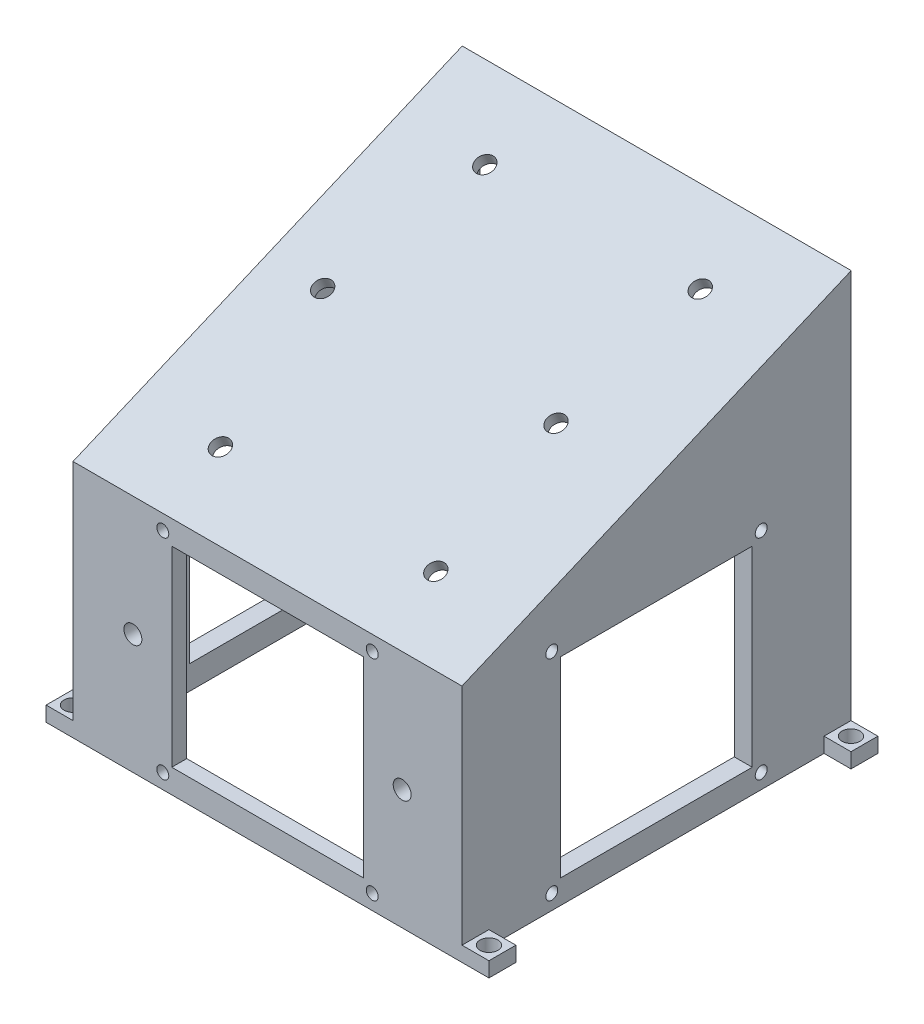
from build123d import *

# Parameters (mm, degrees)
SKETCH_1_W          = 4.5
SKETCH_1_H          = 4.5
SKETCH_1_R          = 1.5
EXTRUDE_1_DEPTH     = 2.5
EXTRUDE_1_2_DEPTH   = 2.5
EXTRUDE_1_3_DEPTH   = 2.5
EXTRUDE_1_4_DEPTH   = 2.5
SKETCH_2_W          = 3
SKETCH_2_H          = 65
EXTRUDE_2_DEPTH     = 40
SKETCH_3_W          = 59
SKETCH_3_H          = 40
SKETCH_3_R          = 1
SKETCH_3_R_2        = 1.5
SKETCH_3_W_2        = 32
SKETCH_3_H_2        = 32
EXTRUDE_4_DEPTH     = 2.5
EXTRUDE_5_DEPTH     = 3
EXTRUDE_6_DEPTH     = 3
SKETCH_9_W          = 65
SKETCH_9_H          = 70.660654221
EXTRUDE_8_DEPTH     = 1.8
SKETCH_12_R         = 1
SKETCH_12_W         = 32
SKETCH_12_H         = 32
CUT_EXTRUDE_2_DEPTH = 65
CUT_EXTRUDE_6_DEPTH = 65
SKETCH_14_R         = 1.5
CUT_EXTRUDE_8_DEPTH = 1.8


with BuildPart() as part:
    # 草图1 → 凸台-拉伸1 (new body)
    with BuildSketch(Plane(origin=(0, 0, 0), x_dir=(1, 0, 0), z_dir=(0, 1, 0))):
        with Locations((-34.75, -30.25)):
            Rectangle(SKETCH_1_W, SKETCH_1_H)
        with Locations(Location((-34.75, -30.25, 0), (0, 0, 270))):
            Circle(SKETCH_1_R, mode=Mode.SUBTRACT)
    extrude(amount=EXTRUDE_1_DEPTH)



with BuildPart() as body_2:
    # 草图1 → Extrude 1 2 (new body)
    with BuildSketch(Plane(origin=(0, 0, 0), x_dir=(1, 0, 0), z_dir=(0, 1, 0))):
        with Locations((34.75, -30.25)):
            Rectangle(SKETCH_1_W, SKETCH_1_H)
        with Locations(Location((34.75, -30.25, 0), (0, 0, 270))):
            Circle(SKETCH_1_R, mode=Mode.SUBTRACT)
    extrude(amount=EXTRUDE_1_2_DEPTH)


with BuildPart() as body_3:
    # 草图1 → Extrude 1 3 (new body)
    with BuildSketch(Plane(origin=(0, 0, 0), x_dir=(1, 0, 0), z_dir=(0, 1, 0))):
        with Locations((34.75, 30.25)):
            Rectangle(SKETCH_1_W, SKETCH_1_H)
        with Locations(Location((34.75, 30.25, 0), (0, 0, 270))):
            Circle(SKETCH_1_R, mode=Mode.SUBTRACT)
    extrude(amount=EXTRUDE_1_3_DEPTH)


with BuildPart() as body_4:
    # 草图1 → Extrude 1 4 (new body)
    with BuildSketch(Plane(origin=(0, 0, 0), x_dir=(1, 0, 0), z_dir=(0, 1, 0))):
        with Locations((-34.75, 30.25)):
            Rectangle(SKETCH_1_W, SKETCH_1_H)
        with Locations(Location((-34.75, 30.25, 0), (0, 0, 270))):
            Circle(SKETCH_1_R, mode=Mode.SUBTRACT)
    extrude(amount=EXTRUDE_1_4_DEPTH)


with BuildPart() as part_1:
    add(part.part)

    add(body_2.part)  # 凸台-拉伸2 merges body 2

    add(body_3.part)  # 凸台-拉伸2 merges body 3

    add(body_4.part)  # 凸台-拉伸2 merges body 4
    # 草图2 → 凸台-拉伸2 (add)
    with BuildSketch(Plane(origin=(0, 0, 0), x_dir=(-1, 0, 0), z_dir=(0, -1, 0))):
        with Locations((31, 0)):
            Rectangle(SKETCH_2_W, SKETCH_2_H)
        with Locations((-31, 0)):
            Rectangle(SKETCH_2_W, SKETCH_2_H)
    extrude(amount=-EXTRUDE_2_DEPTH)

    # 草图5 → 凸台-拉伸5 (add)
    with BuildSketch(Plane.ZY.offset(32.5)):
        Polygon((32.5, 40), (-19.677687078, 62.148114133), (-32.543475158, 67.609317163), (-32.5, 40), align=None)
    extrude(amount=-EXTRUDE_5_DEPTH)

    # 草图8 → 凸台-拉伸6 (add)
    with BuildSketch(Plane(origin=(32.5, 0, 0), x_dir=(0, 0, -1), z_dir=(1, 0, 0))):
        Polygon((-32.5, 40), (32.5, 40), (32.543475158, 67.609317163), align=None)
    extrude(amount=-EXTRUDE_6_DEPTH)



with BuildPart() as body_2_2:
    # 草图3 → 凸台-拉伸4 (new body)
    with BuildSketch(Plane.XY.offset(32.5)):
        with Locations((0, 20)):
            Rectangle(SKETCH_3_W, SKETCH_3_H)
        with Locations((-17.5, 37.5)):
            Circle(SKETCH_3_R, mode=Mode.SUBTRACT)
        with Locations((17.5, 37.5)):
            Circle(SKETCH_3_R, mode=Mode.SUBTRACT)
        with Locations((17.5, 2.5)):
            Circle(SKETCH_3_R, mode=Mode.SUBTRACT)
        with Locations((-17.5, 2.5)):
            Circle(SKETCH_3_R, mode=Mode.SUBTRACT)
        with Locations((-22.5, 20)):
            Circle(SKETCH_3_R_2, mode=Mode.SUBTRACT)
        with Locations((22.5, 20)):
            Circle(SKETCH_3_R_2, mode=Mode.SUBTRACT)
        with Locations((0, 20)):
            Rectangle(SKETCH_3_W_2, SKETCH_3_H_2, mode=Mode.SUBTRACT)
    extrude(amount=-EXTRUDE_4_DEPTH)


with BuildPart() as part_2:
    add(part_1.part)

    add(body_2_2.part)  # 凸台-拉伸8 merges body 2 2
    # 草图9 → 凸台-拉伸8 (add)
    with BuildSketch(Plane(origin=(0, 45.582439165, 19.348597487), x_dir=(1, 0, 0), z_dir=(0, 0.9205048534524402, 0.3907311284892746))):
        with Locations((0, 21.043164513)):
            Rectangle(SKETCH_9_W, SKETCH_9_H)
    extrude(amount=-EXTRUDE_8_DEPTH)

    # 草图12 → 切除-拉伸2 (cut)
    with BuildSketch(Plane.ZY.offset(32.5)):
        with Locations((-17.5, 37.5)):
            Circle(SKETCH_12_R)
        with Locations((17.5, 37.5)):
            Circle(SKETCH_12_R)
        with Locations((17.5, 2.5)):
            Circle(SKETCH_12_R)
        with Locations((-17.5, 2.5)):
            Circle(SKETCH_12_R)
        with Locations((0, 20)):
            Rectangle(SKETCH_12_W, SKETCH_12_H)
    extrude(amount=-CUT_EXTRUDE_2_DEPTH, mode=Mode.SUBTRACT)

    # 草图13 → 切除-拉伸6 (cut)
    with BuildSketch(Plane(origin=(32.5, 0, 0), x_dir=(0, 0, -1), z_dir=(1, 0, 0))):
        Polygon((32.540393941, 65.652560585), (32.540393941, 67.608009264), (33.246791189, 65.952408427), align=None)
    extrude(amount=-CUT_EXTRUDE_6_DEPTH, mode=Mode.SUBTRACT)


with BuildPart() as body_2_3:
    # of the pieces the cut leaves, the one that is kept (cut_extrude_6_keep)
    add(part_2.part.solids().sort_by_distance((37, 0, -32.5))[0])

    # 草图14 → 切除-拉伸8 (cut)
    with BuildSketch(Plane(origin=(0, 45.582439165, 19.348597487), x_dir=(1, 0, 0), z_dir=(0, 0.92050485345244, 0.39073112848927466))):
        with Locations(Location((18, -3.287162598, 0), (0, 0, 270))):
            Circle(SKETCH_14_R)
        with Locations(Location((16, 20.712837402, 0), (0, 0, 270))):
            Circle(SKETCH_14_R)
        with Locations(Location((18, 44.712837402, 0), (0, 0, 270))):
            Circle(SKETCH_14_R)
        with Locations(Location((-18, -3.287162598, 0), (0, 0, 90))):
            Circle(SKETCH_14_R)
        with Locations(Location((-18, 44.712837402, 0), (0, 0, 90))):
            Circle(SKETCH_14_R)
        with Locations(Location((-23, 20.712837402, 0), (0, 0, 270))):
            Circle(SKETCH_14_R)
    extrude(amount=-CUT_EXTRUDE_8_DEPTH, mode=Mode.SUBTRACT)


solid = body_2_3.part
